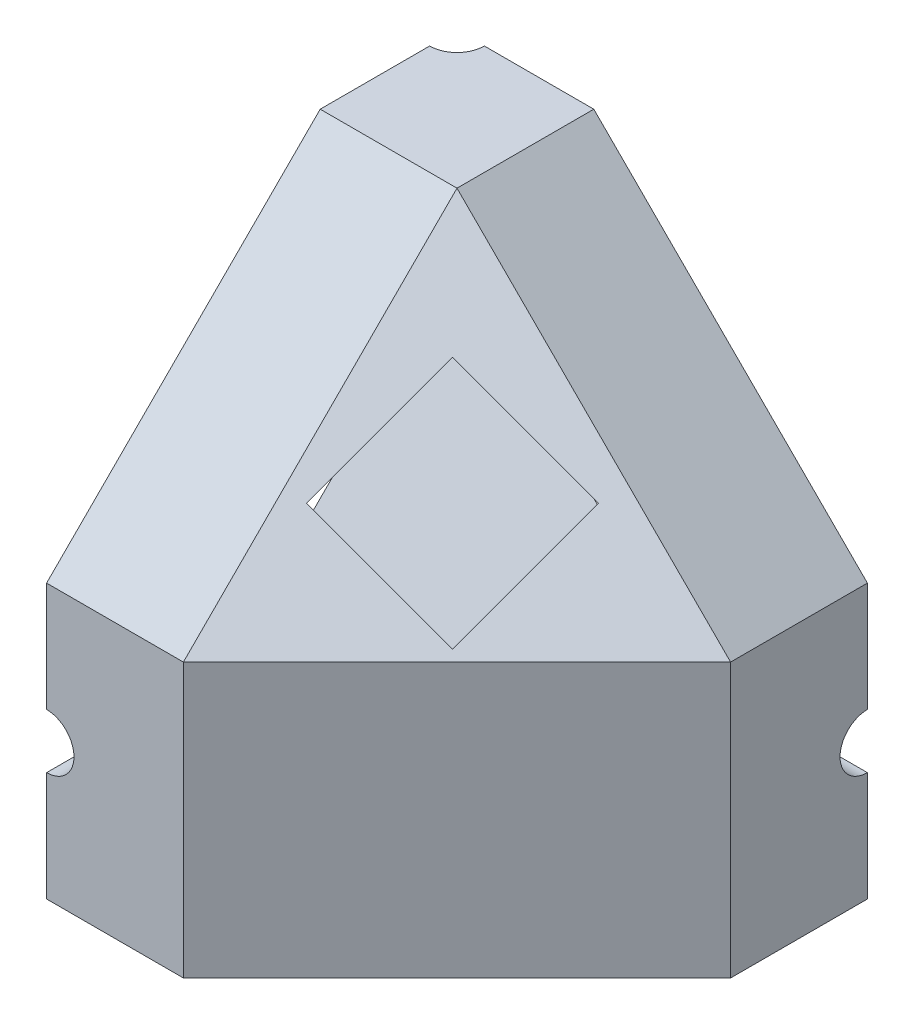
from build123d import *

# Parameters (mm, degrees)
SKETCH1_W           = 30
SKETCH1_H           = 30
BOSS_EXTRUDE1_DEPTH = 30
CUT_EXTRUDE1_DEPTH  = 30
CUT_EXTRUDE2_DEPTH  = 30
CUT_EXTRUDE3_DEPTH  = 30
CUT_EXTRUDE4_DEPTH  = 30
CUT_EXTRUDE5_DEPTH  = 15
SKETCH6_R           = 1.5
CUT_EXTRUDE6_DEPTH  = 20
SKETCH8_R           = 1.5
CUT_EXTRUDE8_DEPTH  = 20
SKETCH10_R          = 1.5
CUT_EXTRUDE10_DEPTH = 20
CUT_EXTRUDE12_DEPTH = 52.961524227
SKETCH16_W          = 28.664479863
SKETCH16_H          = 34.476014612
CUT_EXTRUDE13_DEPTH = 7.5
SKETCH18_R          = 1
CUT_EXTRUDE14_DEPTH = 10
SKETCH19_R          = 1
CUT_EXTRUDE15_DEPTH = 10


with BuildPart() as part:
    # Sketch1 → Boss-Extrude1 (new body)
    with BuildSketch(Plane.XY):
        with Locations((15, 15)):
            Rectangle(SKETCH1_W, SKETCH1_H)
    extrude(amount=-BOSS_EXTRUDE1_DEPTH)

    # Sketch2 → Cut-Extrude1 (cut)
    with BuildSketch(Plane.XY):
        Polygon((15, 30), (30, 15), (45, 15), (45, 45.619084343), (15, 40.368332998), align=None)
    extrude(amount=-CUT_EXTRUDE1_DEPTH, mode=Mode.SUBTRACT)

    # Sketch3 → Cut-Extrude2 (cut)
    with BuildSketch(Plane.ZY):
        Polygon((0, 15), (-15, 30), (-15, 36.177250049), (9.539630377, 36.177250049), (9.539630377, 15), align=None)
    extrude(amount=-CUT_EXTRUDE2_DEPTH, mode=Mode.SUBTRACT)

    # Sketch4 → Cut-Extrude3 (cut)
    with BuildSketch(Plane.XZ):
        Polygon((15, 0), (30, -15), (40.227840819, -15), (40.227840819, 9.317096887), (15, 8.966367386), align=None)
    extrude(amount=-CUT_EXTRUDE3_DEPTH, mode=Mode.SUBTRACT)

    # 3DSketch1 → Cut-Extrude4 (cut)
    with BuildSketch(Plane(origin=(33.996909354, 3.570047518, -7.566956872), x_dir=(-0.34464530014522, 0.4926249601560642, 0.7990871452595439), z_dir=(-0.2113248654051872, 0.788675134594813, -0.5773502691896257))):
        Polygon((0, 0), (25.47550653, -16.637081723), (36.340550094, 0), (10.865043564, 16.637081723), align=None)
    extrude(amount=CUT_EXTRUDE4_DEPTH, mode=Mode.SUBTRACT)

    # Sketch5 → Cut-Extrude5 (cut)
    with BuildSketch(Plane(origin=(10, 10, 10), x_dir=(0.4082482904638628, 0.40824829046386263, -0.8164965809277264), z_dir=(0.5773502691896263, 0.5773502691896258, 0.5773502691896254))):
        Polygon((19.457058725, 2.946852636), (27.184465336, 5.017404997), (29.255017696, -2.710001614), (21.527611086, -4.780553975), align=None)
    extrude(amount=-CUT_EXTRUDE5_DEPTH, mode=Mode.SUBTRACT)

    # Sketch6 → Cut-Extrude6 (cut)
    with BuildSketch(Plane(origin=(0, 30, 0), x_dir=(1, 0, 0), z_dir=(0, 1, 0))):
        with Locations(Location((7.5, 22.5, 0), (0, 0, 270))):
            Circle(SKETCH6_R)
    extrude(amount=-CUT_EXTRUDE6_DEPTH, mode=Mode.SUBTRACT)

    # Sketch8 → Cut-Extrude8 (cut)
    with BuildSketch(Plane.XY):
        with Locations((7.5, 7.5)):
            Circle(SKETCH8_R)
    extrude(amount=-CUT_EXTRUDE8_DEPTH, mode=Mode.SUBTRACT)

    # Sketch10 → Cut-Extrude10 (cut)
    with BuildSketch(Plane(origin=(30, 0, 0), x_dir=(0, 0, -1), z_dir=(1, 0, 0))):
        with Locations(Location((22.5, 7.5, 0), (0, 0, 90))):
            Circle(SKETCH10_R)
    extrude(amount=-CUT_EXTRUDE10_DEPTH, mode=Mode.SUBTRACT)

    # Sketch14 → Cut-Extrude12 (cut, through all)
    with BuildSketch(Plane(origin=(0, 30, 0), x_dir=(1, 0, 0), z_dir=(0, 1, 0))):
        Polygon((0, 31.6), (32.521135015, 31.6), (32.521135015, 22.5), (6, 22.5), (0, 22.5), align=None)
    extrude(amount=-CUT_EXTRUDE12_DEPTH, mode=Mode.SUBTRACT)

    # Sketch16 → Cut-Extrude13 (cut)
    with BuildSketch(Plane.ZY):
        with Locations((-14.332239932, 17.238007306)):
            Rectangle(SKETCH16_W, SKETCH16_H)
    extrude(amount=-CUT_EXTRUDE13_DEPTH, mode=Mode.SUBTRACT)

    # Sketch18 → Cut-Extrude14 (cut)
    with BuildSketch(Plane.ZY.offset(-7.5)):
        with Locations(Location((-17.5, 24, 0), (0, 0, 270))):
            Circle(SKETCH18_R)
        with Locations(Location((-6, 3, 0), (0, 0, 270))):
            Circle(SKETCH18_R)
    extrude(amount=-CUT_EXTRUDE14_DEPTH, mode=Mode.SUBTRACT)

    # Sketch19 → Cut-Extrude15 (cut)
    with BuildSketch(Plane(origin=(0, 0, -22.5), x_dir=(-1, 0, 0), z_dir=(0, 0, -1))):
        with Locations((-25, 14)):
            Circle(SKETCH19_R)
        with Locations((-18, 3)):
            Circle(SKETCH19_R)
    extrude(amount=-CUT_EXTRUDE15_DEPTH, mode=Mode.SUBTRACT)


solid = part.part
